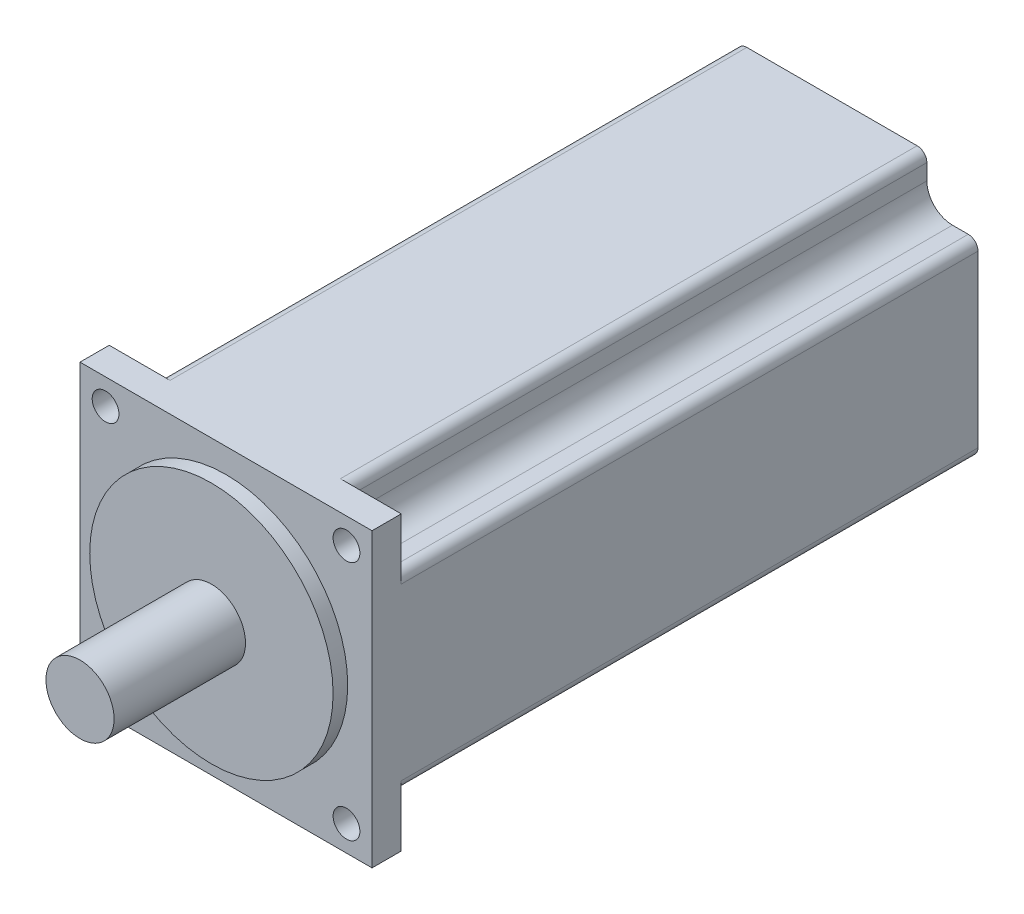
from build123d import *

# Parameters (mm, degrees)
SKETCH_1_W          = 60
SKETCH_1_H          = 60
EXTRUDE_1_DEPTH     = 124.5
SKETCH_2_R          = 25
EXTRUDE_2_DEPTH     = 3
SKETCH_3_R          = 7
EXTRUDE_3_DEPTH     = 27
SKETCH_4_R          = 2.75
CUT_EXTRUDE_1_DEPTH = 151.666021385
CUT_EXTRUDE_2_DEPTH = 118.5
FILLET_1_R          = 2


with BuildPart() as part:
    # 草图1 → 拉伸1 (new body)
    with BuildSketch(Plane.XY):
        with Locations((30, -30)):
            Rectangle(SKETCH_1_W, SKETCH_1_H)
    extrude(amount=EXTRUDE_1_DEPTH)

    # 草图2 → 拉伸2 (add)
    with BuildSketch(Plane.XY.offset(124.5)):
        with Locations((30, -30)):
            Circle(SKETCH_2_R)
    extrude(amount=EXTRUDE_2_DEPTH)

    # 草图3 → 拉伸3 (add)
    with BuildSketch(Plane.XY.offset(127.5)):
        with Locations((30, -30)):
            Circle(SKETCH_3_R)
    extrude(amount=EXTRUDE_3_DEPTH)

    # 草图4 → 切除-拉伸1 (cut, through all)
    with BuildSketch(Plane.XY.offset(124.5)):
        with Locations((54.748737342, -5.251262658)):
            Circle(SKETCH_4_R)
        with Locations((54.748737342, -54.748737342)):
            Circle(SKETCH_4_R)
        with Locations((5.251262658, -54.748737342)):
            Circle(SKETCH_4_R)
        with Locations((5.251262658, -5.251262658)):
            Circle(SKETCH_4_R)
    extrude(amount=-CUT_EXTRUDE_1_DEPTH, mode=Mode.SUBTRACT)

    # 草图5 → 切除-拉伸2 (cut)
    with BuildSketch(Plane(origin=(0, 0, 0), x_dir=(-1, 0, 0), z_dir=(0, 0, -1))):
        with BuildLine():
            Line((-10.502525317, -5.251262658), (-10.502525317, 0))
            Line((-10.502525317, 0), (0, 0))
            Line((0, 0), (0, -10.502525317))
            Line((0, -10.502525317), (-5.251262658, -10.502525317))
            ThreePointArc((-5.251262658, -10.502525317), (-8.964466094, -8.964466094), (-10.502525317, -5.251262658))
        make_face()
        with BuildLine():
            Line((-49.497474683, -54.748737342), (-49.497474683, -60))
            Line((-49.497474683, -60), (-60, -60))
            Line((-60, -60), (-60, -49.497474683))
            Line((-60, -49.497474683), (-54.748737342, -49.497474683))
            ThreePointArc((-54.748737342, -49.497474683), (-51.035533906, -51.035533906), (-49.497474683, -54.748737342))
        make_face()
        with BuildLine():
            Line((-60, 0), (-49.497474683, 0))
            Line((-49.497474683, 0), (-49.497474683, -5.251262658))
            ThreePointArc((-49.497474683, -5.251262658), (-51.035533906, -8.964466094), (-54.748737342, -10.502525317))
            Line((-54.748737342, -10.502525317), (-60, -10.502525317))
            Line((-60, -10.502525317), (-60, 0))
        make_face()
        with BuildLine():
            Line((0, -60), (-10.502525317, -60))
            Line((-10.502525317, -60), (-10.502525317, -54.748737342))
            ThreePointArc((-10.502525317, -54.748737342), (-8.964466094, -51.035533906), (-5.251262658, -49.497474683))
            Line((-5.251262658, -49.497474683), (0, -49.497474683))
            Line((0, -49.497474683), (0, -60))
        make_face()
    extrude(amount=-CUT_EXTRUDE_2_DEPTH, mode=Mode.SUBTRACT)

    # 圆角1
    fillet_1_edges = [part.edges().sort_by_distance(p)[0] for p in [
        (10.502525317, 0, 59.25),
        (0, -10.502525317, 59.25),
        (49.497474683, -60, 59.25),
        (60, -49.497474683, 59.25),
        (60, -10.502525317, 59.25),
        (49.497474683, 0, 59.25),
        (0, -49.497474683, 59.25),
        (10.502525317, -60, 59.25),
    ]]
    fillet(fillet_1_edges, radius=FILLET_1_R)


solid = part.part
